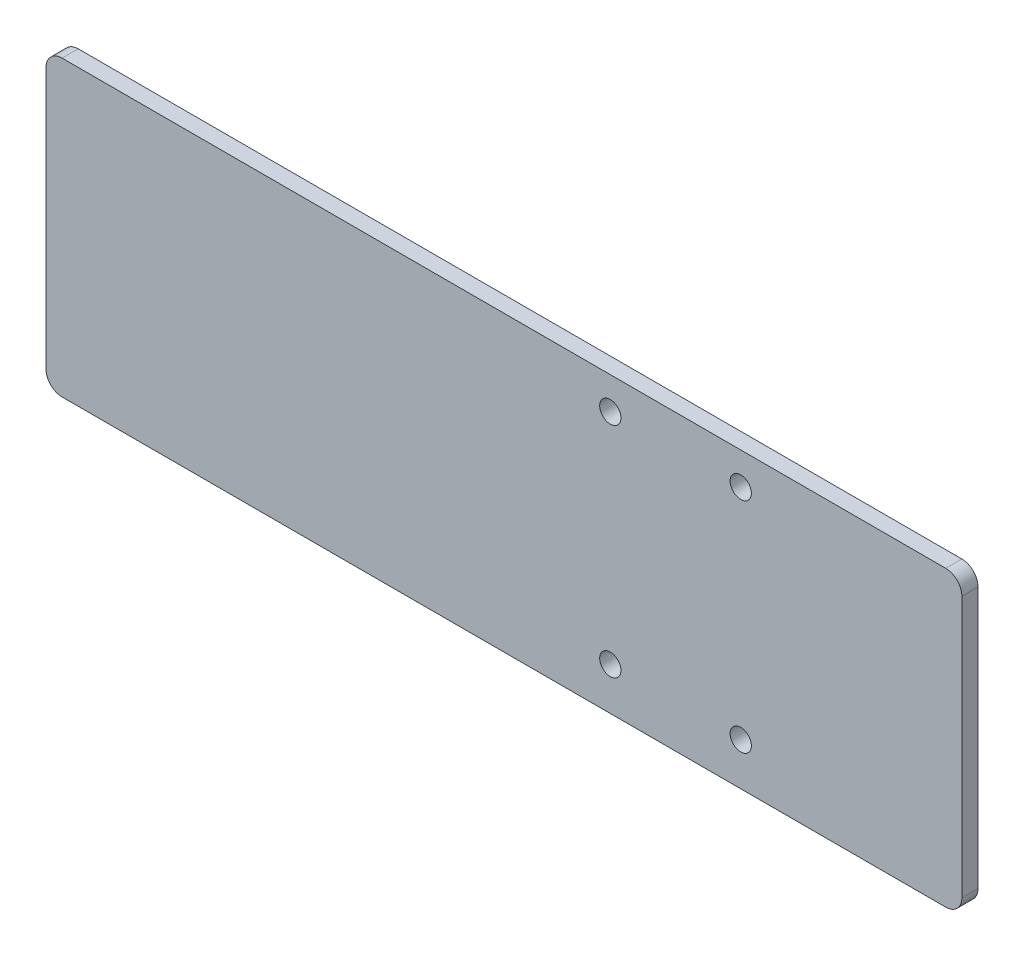
from build123d import *

# Parameters (mm, degrees)
BOSS_EXTRUDE1_DEPTH      = 5
M6_CLEARANCE_HOLE2_D     = 6.6
M6_CLEARANCE_HOLE2_DEPTH = 6
M6_CLEARANCE_HOLE2_TIP   = 1.982840043


with BuildPart() as part:
    # Sketch1 → Boss-Extrude1 (new body)
    with BuildSketch(Plane.XY):
        with BuildLine():
            Line((-137, -45.5), (137, -45.5))
            ThreePointArc((137, -45.5), (140.535533906, -44.035533906), (142, -40.5))
            Line((142, -40.5), (142, 40.5))
            ThreePointArc((142, 40.5), (140.535533906, 44.035533906), (137, 45.5))
            Line((137, 45.5), (-137, 45.5))
            ThreePointArc((-137, 45.5), (-140.535533906, 44.035533906), (-142, 40.5))
            Line((-142, 40.5), (-142, -40.5))
            ThreePointArc((-142, -40.5), (-140.535533906, -44.035533906), (-137, -45.5))
        make_face()
    extrude(amount=BOSS_EXTRUDE1_DEPTH)

    # M6 Clearance Hole2
    with Locations(Plane(origin=(0, 0, 0), x_dir=(-1, 0, 0), z_dir=(0, 0, -1))):
        with Locations((-73.431614003, -32.299177438), (-32.987686721, -32.299177438), (-32.987686721, 35.509212796), (-73.431614003, 35.509212796)):
            Hole(M6_CLEARANCE_HOLE2_D / 2, depth=M6_CLEARANCE_HOLE2_DEPTH)
            with Locations((0, 0, -(M6_CLEARANCE_HOLE2_DEPTH + M6_CLEARANCE_HOLE2_TIP / 2))):  # 118° drill point
                Cone(0, M6_CLEARANCE_HOLE2_D / 2, M6_CLEARANCE_HOLE2_TIP, mode=Mode.SUBTRACT)


solid = part.part
